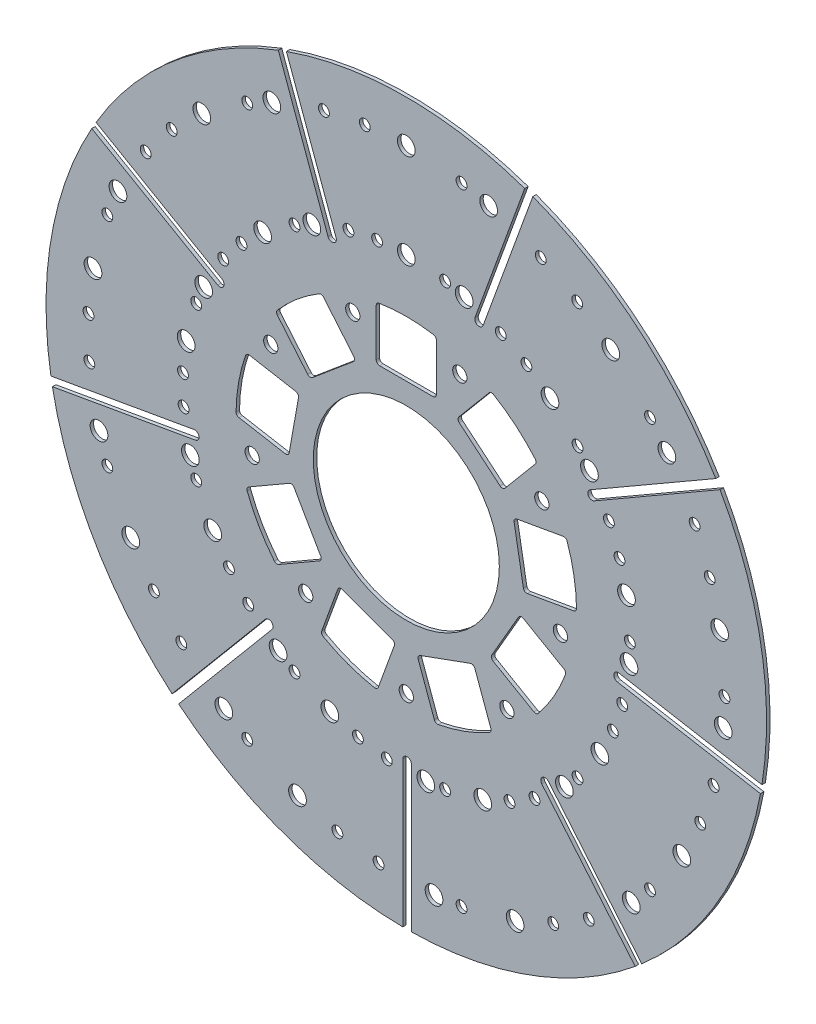
from build123d import *

# Parameters (mm, degrees)
ESBO_O1_R                = 209.5
ESBO_O1_R_2              = 54.1
RESSALTO_EXTRUS_O1_DEPTH = 2
CORTE_EXTRUS_O1_DEPTH    = 2
ESBO_O3_R                = 5.15
ESBO_O3_R_2              = 3.15
CORTE_EXTRUS_O2_DEPTH    = 2
CORTE_EXTRUS_O3_DEPTH    = 2
ESBO_O5_R                = 4.15
CORTE_EXTRUS_O4_DEPTH    = 2
FILETE1_R                = 2


with BuildPart() as part:
    # Esboço1 → Ressalto-extrusão1 (new body)
    with BuildSketch(Plane.XY):
        Circle(ESBO_O1_R)
        Circle(ESBO_O1_R_2, mode=Mode.SUBTRACT)
    extrude(amount=RESSALTO_EXTRUS_O1_DEPTH)

    # Esboço2 → Corte-extrusão1 (cut)
    with BuildSketch(Plane.XY.offset(2)):
        with BuildLine():
            Line((-132.398970068, -162.386900163), (-134.314081176, -160.779931139))
            Line((-134.314081176, -160.779931139), (-136.229192283, -159.172962115))
            Line((-136.229192283, -159.172962115), (-81.912845641, -94.441260867))
            ThreePointArc((-81.912845641, -94.441260867), (-78.390765509, -94.133118783), (-78.082623425, -97.655198915))
            Line((-78.082623425, -97.655198915), (-132.398970068, -162.386900163))
        make_face()
        with BuildLine():
            Line((-205.803782695, -39.29116501), (-206.237903139, -36.829145628))
            Line((-206.237903139, -36.829145628), (-206.672023584, -34.367126245))
            Line((-206.672023584, -34.367126245), (-123.454552552, -19.693640836))
            ThreePointArc((-123.454552552, -19.693640836), (-120.558412725, -21.721539774), (-122.586311663, -24.617679601))
            Line((-122.586311663, -24.617679601), (-205.803782695, -39.29116501))
        make_face()
        with BuildLine():
            Line((-182.910718145, 102.189342923), (-181.660718145, 104.354406433))
            Line((-181.660718145, 104.354406433), (-180.410718145, 106.519469942))
            Line((-180.410718145, 106.519469942), (-107.230502279, 64.268852612))
            ThreePointArc((-107.230502279, 64.268852612), (-106.315438769, 60.853789103), (-109.730502279, 59.938725593))
            Line((-109.730502279, 59.938725593), (-182.910718145, 102.189342923))
        make_face()
        with BuildLine():
            Line((-74.431695749, 195.854321595), (-72.082464197, 196.709371953))
            Line((-72.082464197, 196.709371953), (-69.733232645, 197.564422312))
            Line((-69.733232645, 197.564422312), (-40.832108256, 118.159235655))
            ThreePointArc((-40.832108256, 118.159235655), (-42.326289449, 114.954953744), (-45.530571359, 116.449134938))
            Line((-45.530571359, 116.449134938), (-74.431695749, 195.854321595))
        make_face()
        with BuildLine():
            Line((68.874744304, 197.876886514), (71.223975856, 197.021836156))
            Line((71.223975856, 197.021836156), (73.573207408, 196.166785798))
            Line((73.573207408, 196.166785798), (44.672083019, 116.76159914))
            ThreePointArc((44.672083019, 116.76159914), (41.467801109, 115.267417947), (39.973619915, 118.471699857))
            Line((39.973619915, 118.471699857), (68.874744304, 197.876886514))
        make_face()
        with BuildLine():
            Line((179.95392604, 107.310657077), (181.20392604, 105.145593567))
            Line((181.20392604, 105.145593567), (182.45392604, 102.980530058))
            Line((182.45392604, 102.980530058), (109.273710174, 60.729912728))
            ThreePointArc((109.273710174, 60.729912728), (105.858646664, 61.644976237), (106.773710174, 65.060039747))
            Line((106.773710174, 65.060039747), (179.95392604, 107.310657077))
        make_face()
        with BuildLine():
            Line((206.830665817, -33.467421432), (206.396545373, -35.929440815))
            Line((206.396545373, -35.929440815), (205.962424929, -38.391460197))
            Line((205.962424929, -38.391460197), (122.744953896, -23.717974788))
            ThreePointArc((122.744953896, -23.717974788), (120.717054958, -20.821834961), (123.613194785, -18.793936023))
            Line((123.613194785, -18.793936023), (206.830665817, -33.467421432))
        make_face()
        with BuildLine():
            Line((136.929038391, -158.585721504), (135.013927283, -160.192690528))
            Line((135.013927283, -160.192690528), (133.098816175, -161.799659552))
            Line((133.098816175, -161.799659552), (78.782469533, -97.067958305))
            ThreePointArc((78.782469533, -97.067958305), (79.090611616, -93.545878173), (82.612691748, -93.854020256))
            Line((82.612691748, -93.854020256), (136.929038391, -158.585721504))
        make_face()
        with BuildLine():
            Line((2.956792105, -209.5), (0.456792105, -209.5))
            Line((0.456792105, -209.5), (-2.043207895, -209.5))
            Line((-2.043207895, -209.5), (-2.043207895, -124.99876534))
            ThreePointArc((-2.043207895, -124.99876534), (0.456792105, -122.49876534), (2.956792105, -124.99876534))
            Line((2.956792105, -124.99876534), (2.956792105, -209.5))
        make_face()
    extrude(amount=-CORTE_EXTRUS_O1_DEPTH, mode=Mode.SUBTRACT)

    # Esboço3 → Corte-extrusão2 (cut)
    with BuildSketch(Plane.XY.offset(2)):
        with Locations((0, 185)):
            Circle(ESBO_O3_R)
        with Locations((0, 130)):
            Circle(ESBO_O3_R)
        with Locations((-24.147345561, 183.417299354)):
            Circle(ESBO_O3_R_2)
        with Locations((32.124912868, 182.189434307)):
            Circle(ESBO_O3_R_2)
        with Locations((22.574263097, 128.025007892)):
            Circle(ESBO_O3_R_2)
        with Locations((-16.968404989, 128.887831979)):
            Circle(ESBO_O3_R_2)
        with Locations((-33.646475863, 125.570357418)):
            Circle(ESBO_O3_R_2)
        with Locations((33.646475863, 125.570357418)):
            Circle(ESBO_O3_R)
        with Locations((-47.881523344, 178.696277863)):
            Circle(ESBO_O3_R_2)
        with Locations((47.881523344, 178.696277863)):
            Circle(ESBO_O3_R)
        with Locations((118.915707792, 141.718221977)):
            Circle(ESBO_O3_R)
        with Locations((83.562389259, 99.585777605)):
            Circle(ESBO_O3_R)
        with Locations((99.400427544, 156.027417475)):
            Circle(ESBO_O3_R_2)
        with Locations((141.718221977, 118.915707792)):
            Circle(ESBO_O3_R_2)
        with Locations((99.585777605, 83.562389259)):
            Circle(ESBO_O3_R_2)
        with Locations((69.848949085, 109.640887956)):
            Circle(ESBO_O3_R_2)
        with Locations((54.940374026, 117.820012315)):
            Circle(ESBO_O3_R_2)
        with Locations((106.489765758, 74.564936726)):
            Circle(ESBO_O3_R)
        with Locations((78.184378422, 167.666940602)):
            Circle(ESBO_O3_R_2)
        with Locations((151.543128193, 106.111640725)):
            Circle(ESBO_O3_R)
        with Locations((182.189434307, 32.124912868)):
            Circle(ESBO_O3_R)
        with Locations((128.025007892, 22.574263097)):
            Circle(ESBO_O3_R)
        with Locations((176.437635888, 55.630572908)):
            Circle(ESBO_O3_R_2)
        with Locations((185, 0)):
            Circle(ESBO_O3_R_2)
        with Locations((130, 0)):
            Circle(ESBO_O3_R_2)
        with Locations((123.983203597, 39.091753936)):
            Circle(ESBO_O3_R_2)
        with Locations((117.820012315, 54.940374026)):
            Circle(ESBO_O3_R_2)
        with Locations((129.505310752, -11.330246557)):
            Circle(ESBO_O3_R)
        with Locations((167.666940602, 78.184378422)):
            Circle(ESBO_O3_R_2)
        with Locations((184.296019147, -16.123812408)):
            Circle(ESBO_O3_R)
        with Locations((160.2146997, -92.5)):
            Circle(ESBO_O3_R)
        with Locations((112.583302492, -65)):
            Circle(ESBO_O3_R)
        with Locations((170.917713515, -70.796434988)):
            Circle(ESBO_O3_R_2)
        with Locations((141.718221977, -118.915707792)):
            Circle(ESBO_O3_R_2)
        with Locations((99.585777605, -83.562389259)):
            Circle(ESBO_O3_R_2)
        with Locations((120.104339226, -49.748846207)):
            Circle(ESBO_O3_R_2)
        with Locations((125.570357418, -33.646475863)):
            Circle(ESBO_O3_R_2)
        with Locations((91.923881554, -91.923881554)):
            Circle(ESBO_O3_R)
        with Locations((178.696277863, -47.881523344)):
            Circle(ESBO_O3_R_2)
        with Locations((130.81475452, -130.81475452)):
            Circle(ESBO_O3_R)
        with Locations((63.273726515, -173.843134845)):
            Circle(ESBO_O3_R)
        with Locations((44.462618632, -122.160040702)):
            Circle(ESBO_O3_R)
        with Locations((85.423493448, -164.097004138)):
            Circle(ESBO_O3_R_2)
        with Locations((32.124912868, -182.189434307)):
            Circle(ESBO_O3_R_2)
        with Locations((22.574263097, -128.025007892)):
            Circle(ESBO_O3_R_2)
        with Locations((60.027319721, -115.311408313)):
            Circle(ESBO_O3_R_2)
        with Locations((74.564936726, -106.489765758)):
            Circle(ESBO_O3_R_2)
        with Locations((11.330246557, -129.505310752)):
            Circle(ESBO_O3_R)
        with Locations((106.111640725, -151.543128193)):
            Circle(ESBO_O3_R_2)
        with Locations((16.123812408, -184.296019147)):
            Circle(ESBO_O3_R)
        with Locations((-63.273726515, -173.843134845)):
            Circle(ESBO_O3_R)
        with Locations((-44.462618632, -122.160040702)):
            Circle(ESBO_O3_R)
        with Locations((-40.041328579, -180.614761317)):
            Circle(ESBO_O3_R_2)
        with Locations((-92.5, -160.2146997)):
            Circle(ESBO_O3_R_2)
        with Locations((-65, -112.583302492)):
            Circle(ESBO_O3_R_2)
        with Locations((-28.137149812, -126.918480926)):
            Circle(ESBO_O3_R_2)
        with Locations((-11.330246557, -129.505310752)):
            Circle(ESBO_O3_R_2)
        with Locations((-74.564936726, -106.489765758)):
            Circle(ESBO_O3_R)
        with Locations((-16.123812408, -184.296019147)):
            Circle(ESBO_O3_R_2)
        with Locations((-106.111640725, -151.543128193)):
            Circle(ESBO_O3_R)
        with Locations((-160.2146997, -92.5)):
            Circle(ESBO_O3_R)
        with Locations((-112.583302492, -65)):
            Circle(ESBO_O3_R)
        with Locations((-146.770367954, -112.620864367)):
            Circle(ESBO_O3_R_2)
        with Locations((-173.843134845, -63.273726515)):
            Circle(ESBO_O3_R_2)
        with Locations((-122.160040702, -44.462618632)):
            Circle(ESBO_O3_R_2)
        with Locations((-103.135934238, -79.138985771)):
            Circle(ESBO_O3_R_2)
        with Locations((-91.923881554, -91.923881554)):
            Circle(ESBO_O3_R_2)
        with Locations((-125.570357418, -33.646475863)):
            Circle(ESBO_O3_R)
        with Locations((-130.81475452, -130.81475452)):
            Circle(ESBO_O3_R_2)
        with Locations((-178.696277863, -47.881523344)):
            Circle(ESBO_O3_R)
        with Locations((-182.189434307, 32.124912868)):
            Circle(ESBO_O3_R)
        with Locations((-128.025007892, 22.574263097)):
            Circle(ESBO_O3_R)
        with Locations((-184.823920993, 8.069586663)):
            Circle(ESBO_O3_R_2)
        with Locations((-173.843134845, 63.273726515)):
            Circle(ESBO_O3_R_2)
        with Locations((-122.160040702, 44.462618632)):
            Circle(ESBO_O3_R_2)
        with Locations((-129.876268806, 5.670520357)):
            Circle(ESBO_O3_R_2)
        with Locations((-129.505310752, -11.330246557)):
            Circle(ESBO_O3_R_2)
        with Locations((-117.820012315, 54.940374026)):
            Circle(ESBO_O3_R)
        with Locations((-184.296019147, -16.123812408)):
            Circle(ESBO_O3_R_2)
        with Locations((-167.666940602, 78.184378422)):
            Circle(ESBO_O3_R)
        with Locations((-118.915707792, 141.718221977)):
            Circle(ESBO_O3_R)
        with Locations((-83.562389259, 99.585777605)):
            Circle(ESBO_O3_R)
        with Locations((-136.39630731, 124.984188409)):
            Circle(ESBO_O3_R_2)
        with Locations((-92.5, 160.2146997)):
            Circle(ESBO_O3_R_2)
        with Locations((-65, 112.583302492)):
            Circle(ESBO_O3_R_2)
        with Locations((-95.846053785, 87.82672699)):
            Circle(ESBO_O3_R_2)
        with Locations((-106.489765758, 74.564936726)):
            Circle(ESBO_O3_R_2)
        with Locations((-54.940374026, 117.820012315)):
            Circle(ESBO_O3_R)
        with Locations((-151.543128193, 106.111640725)):
            Circle(ESBO_O3_R_2)
        with Locations((-78.184378422, 167.666940602)):
            Circle(ESBO_O3_R)
    extrude(amount=-CORTE_EXTRUS_O2_DEPTH, mode=Mode.SUBTRACT)

    # Esboço4 → Corte-extrusão3 (cut)
    with BuildSketch(Plane.XY.offset(2)):
        with BuildLine():
            Line((29.275319529, 62.114134193), (56.086875038, 39.616567854))
            Line((56.086875038, 39.616567854), (76.03965024, 63.395359383))
            ThreePointArc((76.03965024, 63.395359383), (63.635973359, 75.838399869), (49.228094731, 85.892925722))
            Line((49.228094731, 85.892925722), (29.275319529, 62.114134193))
        make_face()
        with BuildLine():
            Line((-17.5, 66.4), (17.5, 66.4))
            Line((17.5, 66.4), (17.5, 97.441007794))
            ThreePointArc((17.5, 97.441007794), (0, 99), (-17.5, 97.441007794))
            Line((-17.5, 97.441007794), (-17.5, 66.4))
        make_face()
        with BuildLine():
            Line((62.352391691, 28.764374675), (68.430077909, -5.703896681))
            Line((68.430077909, -5.703896681), (98.999503046, -0.313682244))
            ThreePointArc((98.999503046, -0.313682244), (97.495967548, 17.191169589), (92.921816828, 34.154589111))
            Line((92.921816828, 34.154589111), (62.352391691, 28.764374675))
        make_face()
        with BuildLine():
            Line((66.254086811, -18.044555434), (48.754086811, -48.355444566))
            Line((48.754086811, -48.355444566), (75.63638812, -63.875948463))
            ThreePointArc((75.63638812, -63.875948463), (85.736514975, -49.5), (93.13638812, -33.565059331))
            Line((93.13638812, -33.565059331), (66.254086811, -18.044555434))
        make_face()
        with BuildLine():
            Line((39.154758381, -56.410237512), (6.265516653, -68.380942528))
            Line((6.265516653, -68.380942528), (16.882166588, -97.549948495))
            ThreePointArc((16.882166588, -97.549948495), (33.859994189, -93.029569458), (49.771408315, -85.579243478))
            Line((49.771408315, -85.579243478), (39.154758381, -56.410237512))
        make_face()
        with BuildLine():
            Line((-6.265516653, -68.380942528), (-39.154758381, -56.410237512))
            Line((-39.154758381, -56.410237512), (-49.771408315, -85.579243478))
            ThreePointArc((-49.771408315, -85.579243478), (-33.859994189, -93.029569458), (-16.882166588, -97.549948495))
            Line((-16.882166588, -97.549948495), (-6.265516653, -68.380942528))
        make_face()
        with BuildLine():
            Line((-48.754086811, -48.355444566), (-66.254086811, -18.044555434))
            Line((-66.254086811, -18.044555434), (-93.13638812, -33.565059331))
            ThreePointArc((-93.13638812, -33.565059331), (-85.736514975, -49.5), (-75.63638812, -63.875948463))
            Line((-75.63638812, -63.875948463), (-48.754086811, -48.355444566))
        make_face()
        with BuildLine():
            Line((-68.430077909, -5.703896681), (-62.352391691, 28.764374675))
            Line((-62.352391691, 28.764374675), (-92.921816828, 34.154589111))
            ThreePointArc((-92.921816828, 34.154589111), (-97.495967548, 17.191169589), (-98.999503046, -0.313682244))
            Line((-98.999503046, -0.313682244), (-68.430077909, -5.703896681))
        make_face()
        with BuildLine():
            Line((-56.086875038, 39.616567854), (-29.275319529, 62.114134193))
            Line((-29.275319529, 62.114134193), (-49.228094731, 85.892925722))
            ThreePointArc((-49.228094731, 85.892925722), (-63.635973359, 75.838399869), (-76.03965024, 63.395359383))
            Line((-76.03965024, 63.395359383), (-56.086875038, 39.616567854))
        make_face()
    extrude(amount=-CORTE_EXTRUS_O3_DEPTH, mode=Mode.SUBTRACT)

    # Esboço5 → Corte-extrusão4 (cut)
    with BuildSketch(Plane.XY.offset(2)):
        with Locations((31.123833043, 85.512028492)):
            Circle(ESBO_O5_R)
        with Locations((78.808311744, 45.5)):
            Circle(ESBO_O5_R)
        with Locations((89.617505524, -15.801984168)):
            Circle(ESBO_O5_R)
        with Locations((58.493672481, -69.710044324)):
            Circle(ESBO_O5_R)
        with Locations((0, -91)):
            Circle(ESBO_O5_R)
        with Locations((-58.493672481, -69.710044324)):
            Circle(ESBO_O5_R)
        with Locations((-89.617505524, -15.801984168)):
            Circle(ESBO_O5_R)
        with Locations((-78.808311744, 45.5)):
            Circle(ESBO_O5_R)
        with Locations((-31.123833043, 85.512028492)):
            Circle(ESBO_O5_R)
    extrude(amount=-CORTE_EXTRUS_O4_DEPTH, mode=Mode.SUBTRACT)

    # Filete1
    filete1_edges = [part.edges().sort_by_distance(p)[0] for p in [
        (-17.5, 66.4, 1),
        (-17.5, 97.441007794, 1),
        (17.5, 97.441007794, 1),
        (17.5, 66.4, 1),
        (29.275319529, 62.114134193, 1),
        (49.228094731, 85.892925722, 1),
        (76.03965024, 63.395359383, 1),
        (56.086875038, 39.616567854, 1),
        (62.352391691, 28.764374675, 1),
        (92.921816828, 34.154589111, 1),
        (98.999503046, -0.313682244, 1),
        (68.430077909, -5.703896681, 1),
        (66.254086811, -18.044555434, 1),
        (93.13638812, -33.565059331, 1),
        (75.63638812, -63.875948463, 1),
        (48.754086811, -48.355444566, 1),
        (39.154758381, -56.410237512, 1),
        (49.771408315, -85.579243478, 1),
        (16.882166588, -97.549948495, 1),
        (6.265516653, -68.380942528, 1),
        (-6.265516653, -68.380942528, 1),
        (-16.882166588, -97.549948495, 1),
        (-49.771408315, -85.579243478, 1),
        (-39.154758381, -56.410237512, 1),
        (-48.754086811, -48.355444566, 1),
        (-75.63638812, -63.875948463, 1),
        (-93.13638812, -33.565059331, 1),
        (-66.254086811, -18.044555434, 1),
        (-68.430077909, -5.703896681, 1),
        (-98.999503046, -0.313682244, 1),
        (-92.921816828, 34.154589111, 1),
        (-62.352391691, 28.764374675, 1),
        (-56.086875038, 39.616567854, 1),
        (-76.03965024, 63.395359383, 1),
        (-49.228094731, 85.892925722, 1),
        (-29.275319529, 62.114134193, 1),
    ]]
    fillet(filete1_edges, radius=FILETE1_R)


solid = part.part
